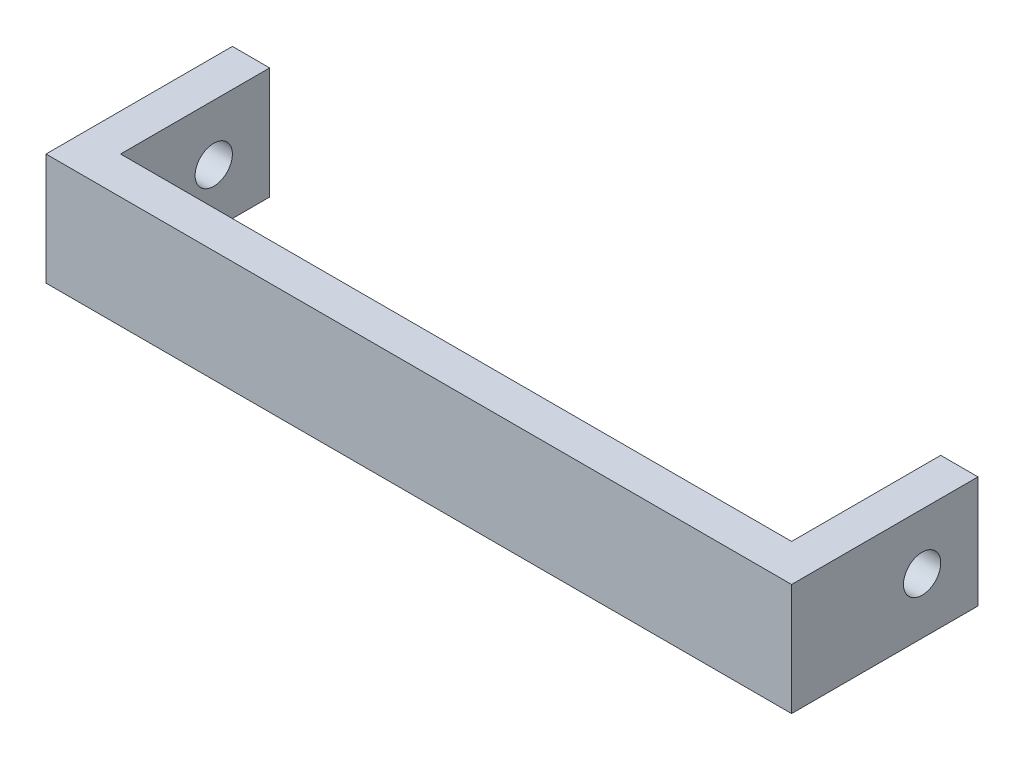
from build123d import *

# Parameters (mm, degrees)
SKETCH1_W           = 100
SKETCH1_H           = 5
SKETCH1_W_2         = 5
SKETCH1_H_2         = 20
BOSS_EXTRUDE1_DEPTH = 15
SKETCH2_R           = 2.5
CUT_EXTRUDE1_DEPTH  = 104.591746776


with BuildPart() as part:
    # Sketch1 → Boss-Extrude1 (new body)
    with BuildSketch(Plane(origin=(0, 0, 0), x_dir=(1, 0, 0), z_dir=(0, 1, 0))):
        Rectangle(SKETCH1_W, SKETCH1_H)
        with Locations((-47.5, 12.5)):
            Rectangle(SKETCH1_W_2, SKETCH1_H_2)
        with Locations((47.5, 12.5)):
            Rectangle(SKETCH1_W_2, SKETCH1_H_2)
    extrude(amount=BOSS_EXTRUDE1_DEPTH)

    # Sketch2 → Cut-Extrude1 (cut, through all)
    with BuildSketch(Plane.ZY.offset(50)):
        with Locations((-15, 7.5)):
            Circle(SKETCH2_R)
    extrude(amount=-CUT_EXTRUDE1_DEPTH, mode=Mode.SUBTRACT)


solid = part.part
